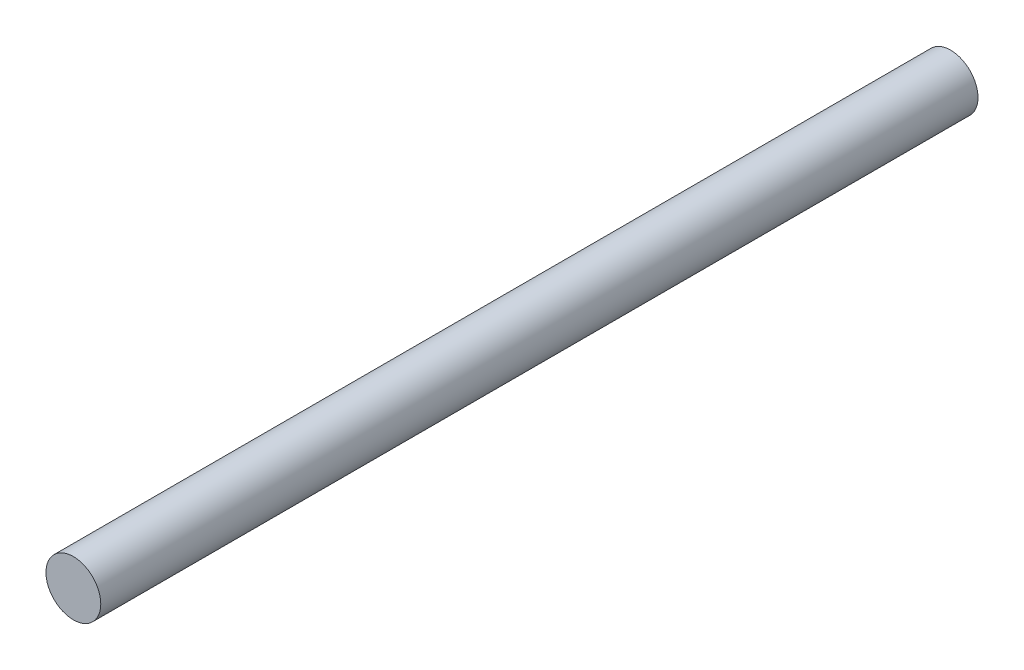
from build123d import *

# Parameters (mm, degrees)
ESQUISSE1_R        = 12.5
BOSS_EXTRU_1_DEPTH = 400


with BuildPart() as part:
    # Esquisse1 → Boss.-Extru.1 (new body)
    with BuildSketch(Plane.XY):
        Circle(ESQUISSE1_R)
    extrude(amount=BOSS_EXTRU_1_DEPTH)


solid = part.part
